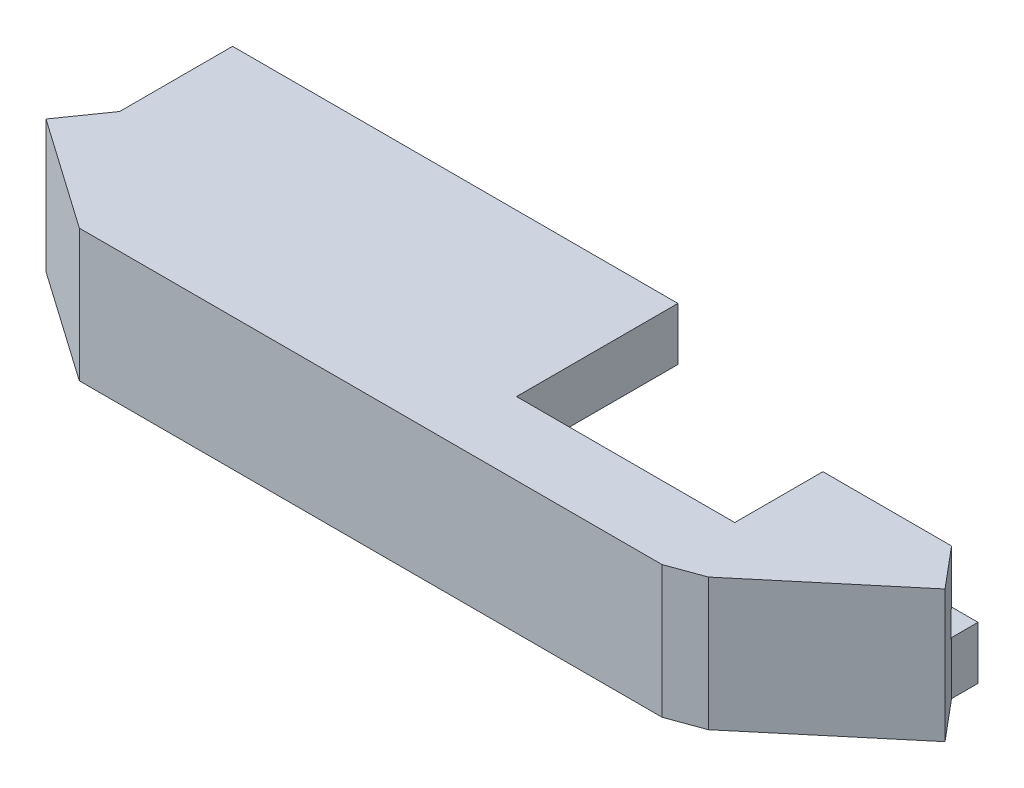
from build123d import *

# Parameters (mm, degrees)
BOSS_EXTRUDE1_DEPTH = 4
BOSS_EXTRUDE3_DEPTH = 2
BOSS_EXTRUDE4_DEPTH = 4


with BuildPart() as part:
    # Sketch2 → Boss-Extrude1 (new body)
    with BuildSketch(Plane(origin=(0, 0, 0), x_dir=(1, 0, 0), z_dir=(0, 1, 0))):
        Polygon((-7.372368399, 13.7), (-7.372368399, 5.162187927), (-9.666674144, 1.88557975), (-1.261195156, -4), (42.8, -4), (45.371150439, -3.064177772), (55.099914866, 5.099224871), (52.528764428, 8.163402643), (42.8, 8.163402643), (42.8, 1.5), (26.3, 1.5), (26.3, 13.7), align=None)
    extrude(amount=BOSS_EXTRUDE1_DEPTH)

    # Sketch2<4> → Boss-Extrude3 (add)
    with BuildSketch(Plane(origin=(0, 0, 0), x_dir=(1, 0, 0), z_dir=(0, 1, 0))):
        with BuildLine():
            Line((-0.094589637, -0.3), (-7.54444133, 4.916442314))
            Line((-7.54444133, 4.916442314), (-9.666674144, 1.88557975))
            Line((-9.666674144, 1.88557975), (-1.261195156, -4))
            Line((-1.261195156, -4), (42.8, -4))
            Line((42.8, -4), (45.371150439, -3.064177772))
            Line((45.371150439, -3.064177772), (55.099914866, 5.099224871))
            Line((55.099914866, 5.099224871), (52.721600711, 7.93358931))
            Line((52.721600711, 7.93358931), (42.992836283, -0.229813333))
            Line((42.992836283, -0.229813333), (42.8, -0.3))
            Line((42.8, -0.3), (18.05881591, -0.3))
            Line((18.05881591, -0.3), (18.05881591, 0.607570661))
            ThreePointArc((18.05881591, 0.607570661), (13.15, 4.2), (8.24118409, 0.607570661))
            Line((8.24118409, 0.607570661), (8.24118409, -0.3))
            Line((8.24118409, -0.3), (-0.094589637, -0.3))
        make_face()
    extrude(amount=-BOSS_EXTRUDE3_DEPTH)

    # Sketch3 → Boss-Extrude4 (add)
    with BuildSketch(Plane(origin=(0, -2, 0), x_dir=(-1, 0, 0), z_dir=(0, -1, 0))):
        Polygon((-42.8, 0), (-44.028764428, 1.031055778), (-44.028764428, 10.163402643), (-52.528764428, 10.163402643), (-52.528764428, 8.163402643), (-55.099914866, 5.099224871), (-45.371150439, -3.064177772), (-42.8, -4), (1.261195156, -4), (9.666674144, 1.88557975), (7.372368399, 5.162187927), (-18.25881591, 5.162187927), (-18.25881591, 0), align=None)
    extrude(amount=BOSS_EXTRUDE4_DEPTH)


solid = part.part
